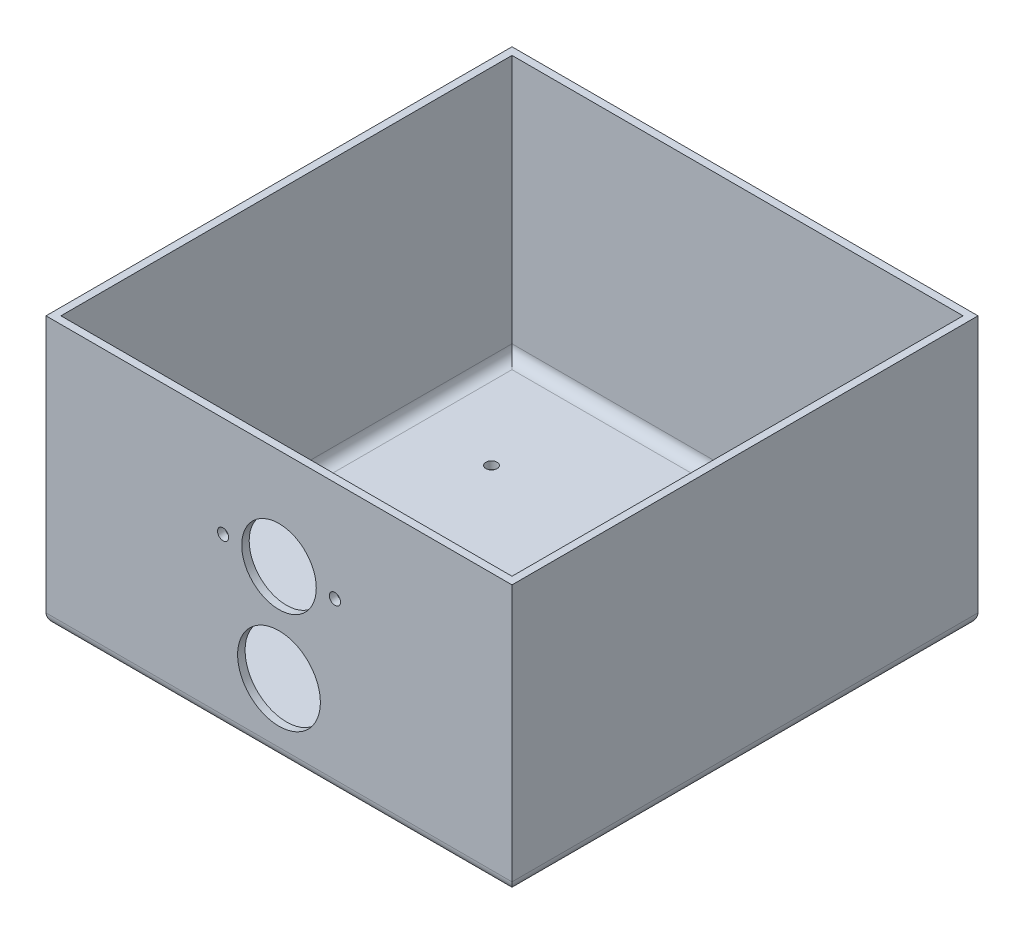
from build123d import *

# Parameters (mm, degrees)
SKETCH1_W           = 125
SKETCH1_H           = 125
SKETCH1_W_2         = 121
SKETCH1_H_2         = 121
BOSS_EXTRUDE1_DEPTH = 70
SKETCH2_W           = 125
SKETCH2_H           = 125
BOSS_EXTRUDE2_DEPTH = 2
SKETCH3_R           = 1.5
CUT_EXTRUDE1_DEPTH  = 3
FILLET2_R           = 3
FILLET3_R           = 3
CUT_EXTRUDE2_REACH  = 158.305
SKETCH4_R           = 11.1
SKETCH4_R_2         = 10
CUT_EXTRUDE3_REACH  = 158.305
SKETCH5_R           = 1.5


with BuildPart() as part:
    # Sketch1 → Boss-Extrude1 (new body)
    with BuildSketch(Plane(origin=(0, 0, 0), x_dir=(1, 0, 0), z_dir=(0, 1, 0))):
        Rectangle(SKETCH1_W, SKETCH1_H)
        Rectangle(SKETCH1_W_2, SKETCH1_H_2, mode=Mode.SUBTRACT)
    extrude(amount=BOSS_EXTRUDE1_DEPTH)

    # Sketch2 → Boss-Extrude2 (add)
    with BuildSketch(Plane.XZ):
        Rectangle(SKETCH2_W, SKETCH2_H)
    extrude(amount=BOSS_EXTRUDE2_DEPTH)

    # Sketch3 → Cut-Extrude1 (cut)
    with BuildSketch(Plane.XZ.offset(2)):
        with Locations(Location((38, -32.5, 0), (0, 0, 270))):
            Circle(SKETCH3_R)
        with Locations(Location((-38, -32.5, 0), (0, 0, 270))):
            Circle(SKETCH3_R)
        with Locations(Location((38, 32.5, 0), (0, 0, 270))):
            Circle(SKETCH3_R)
        with Locations(Location((-38, 32.5, 0), (0, 0, 270))):
            Circle(SKETCH3_R)
    extrude(amount=-CUT_EXTRUDE1_DEPTH, mode=Mode.SUBTRACT)

    # Fillet2
    fillet2_edges = [part.edges().sort_by_distance(p)[0] for p in [
        (-62.5, -2, 0),
        (0, -2, -62.5),
        (62.5, -2, 0),
        (0, -2, 62.5),
    ]]
    fillet(fillet2_edges, radius=FILLET2_R)

    # Fillet3
    fillet3_edges = [part.edges().sort_by_distance(p)[0] for p in [
        (-60.5, 0, 0),
        (0, 0, 60.5),
        (60.5, 0, 0),
        (0, 0, -60.5),
    ]]
    fillet(fillet3_edges, radius=FILLET3_R)

    # Sketch4 → Cut-Extrude2 (cut, up to next)
    with BuildSketch(Plane.XY.offset(62.5), mode=Mode.PRIVATE) as cut_extrude2_sk1:
        with Locations((0, 17)):
            Circle(SKETCH4_R)
    cut_extrude2_tool1 = extrude(cut_extrude2_sk1.sketch, amount=-CUT_EXTRUDE2_REACH, mode=Mode.PRIVATE) & part.part
    # Sketch4 → Cut-Extrude2 (cut, up to next)
    with BuildSketch(Plane.XY.offset(62.5), mode=Mode.PRIVATE) as cut_extrude2_sk2:
        with Locations((0, 43)):
            Circle(SKETCH4_R_2)
    cut_extrude2_tool2 = extrude(cut_extrude2_sk2.sketch, amount=-CUT_EXTRUDE2_REACH, mode=Mode.PRIVATE) & part.part
    add(cut_extrude2_tool1.solids().sort_by_distance((0, 17, 62.5))[0], mode=Mode.SUBTRACT)
    add(cut_extrude2_tool2.solids().sort_by_distance((0, 43, 62.5))[0], mode=Mode.SUBTRACT)

    # Sketch5 → Cut-Extrude3 (cut, up to next)
    with BuildSketch(Plane.XY.offset(62.5), mode=Mode.PRIVATE) as cut_extrude3_sk1:
        with Locations((-15, 43)):
            Circle(SKETCH5_R)
    cut_extrude3_tool1 = extrude(cut_extrude3_sk1.sketch, amount=-CUT_EXTRUDE3_REACH, mode=Mode.PRIVATE) & part.part
    # Sketch5 → Cut-Extrude3 (cut, up to next)
    with BuildSketch(Plane.XY.offset(62.5), mode=Mode.PRIVATE) as cut_extrude3_sk2:
        with Locations(Location((15, 43, 0), (0, 0, 180))):
            Circle(SKETCH5_R)
    cut_extrude3_tool2 = extrude(cut_extrude3_sk2.sketch, amount=-CUT_EXTRUDE3_REACH, mode=Mode.PRIVATE) & part.part
    add(cut_extrude3_tool1.solids().sort_by_distance((-15, 43, 62.5))[0], mode=Mode.SUBTRACT)
    add(cut_extrude3_tool2.solids().sort_by_distance((15, 43, 62.5))[0], mode=Mode.SUBTRACT)


solid = part.part
